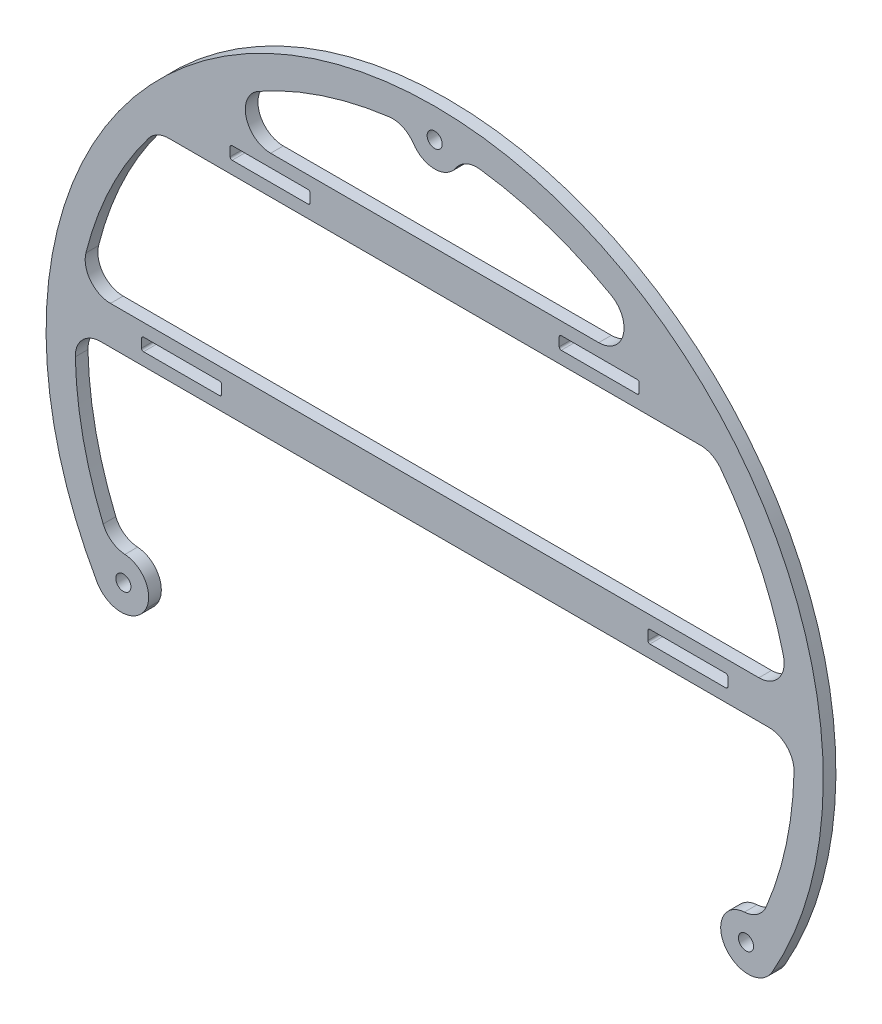
from build123d import *

# Parameters (mm, degrees)
SKETCH1_R           = 97.4725
SKETCH1_R_2         = 90.17
BOSS_EXTRUDE1_DEPTH = 3.175
BOSS_EXTRUDE2_START = -3.175
BOSS_EXTRUDE2_DEPTH = 3.175
CIRPATTERN2_COUNT   = 3
CUT_EXTRUDE1_DEPTH  = 138.883491171
BOSS_EXTRUDE5_START = -3.175
SKETCH13_W          = 20.066
SKETCH13_H          = 3.175
BOSS_EXTRUDE5_DEPTH = 3.175
BOSS_EXTRUDE6_START = -3.175
SKETCH17_W          = 20.066
SKETCH17_H          = 3.175
BOSS_EXTRUDE6_DEPTH = 3.175
FILLET1_R           = 6.35
FILLET2_R           = 0.508


with BuildPart() as part:
    # Sketch1 → Boss-Extrude1 (new body)
    with BuildSketch(Plane.XY):
        Circle(SKETCH1_R)
        Circle(SKETCH1_R_2, mode=Mode.SUBTRACT)
    extrude(amount=BOSS_EXTRUDE1_DEPTH)

    # Sketch2 → Boss-Extrude2 (add)
    with BuildSketch(Plane.XY.offset(3.175).offset(BOSS_EXTRUDE2_START)):
        with BuildLine():
            ThreePointArc((-5.291472464, 86.659612676), (0, 83.82), (5.291472464, 86.659612676))
            ThreePointArc((5.291472464, 86.659612676), (7.940261692, 88.923194985), (11.38468318, 89.448409091))
            ThreePointArc((11.38468318, 89.448409091), (0, 90.17), (-11.38468318, 89.448409091))
            ThreePointArc((-11.38468318, 89.448409091), (-7.940261692, 88.923194985), (-5.291472464, 86.659612676))
        make_face()
    boss_extrude2 = extrude(amount=BOSS_EXTRUDE2_DEPTH)

    # Sketch7 → #6 Clearance Hole2 (revolve, cut)
    with BuildSketch(Plane(origin=(0, 90.17, 0), x_dir=(0, 1, 0), z_dir=(1, 0, 0))):
        Polygon((0, 0), (0, 7.490824014), (1.89865, 6.35), (1.89865, 0), align=None)
    f_6_clearance_hole2 = revolve(axis=Axis((0, 90.17, -6.35), (0, 0, 1)), mode=Mode.SUBTRACT)

    # CirPattern2: Boss-Extrude2, #6 Clearance Hole2 ×3 about axis
    cirpattern2_axis = Axis((0, 0, 0), (0, 0, 1))
    add([boss_extrude2.rotate(cirpattern2_axis, i * 360 / CIRPATTERN2_COUNT) for i in range(1, CIRPATTERN2_COUNT)])
    add([f_6_clearance_hole2.rotate(cirpattern2_axis, i * 360 / CIRPATTERN2_COUNT) for i in range(1, CIRPATTERN2_COUNT)], mode=Mode.SUBTRACT)

    # Sketch14 → Cut-Extrude1 (cut, through all)
    with BuildSketch(Plane.XY.offset(3.175)):
        with BuildLine():
            ThreePointArc((-72.403689828, -47.912355915), (-78.441248685, -51.771990171), (-84.687137855, -48.259475113))
            ThreePointArc((-84.687137855, -48.259475113), (6.18e-07, -97.4725), (84.687138467, -48.25947404))
            ThreePointArc((84.687138467, -48.25947404), (78.441249322, -51.771989501), (72.403689828, -47.912355915))
            ThreePointArc((72.403689828, -47.912355915), (73.039614996, -51.33806583), (71.772253011, -54.583629393))
            ThreePointArc((71.772253011, -54.583629393), (0, -90.17), (-71.772253011, -54.583629393))
            ThreePointArc((-71.772253011, -54.583629393), (-73.039614996, -51.33806583), (-72.403689828, -47.912355915))
        make_face()
    extrude(amount=-CUT_EXTRUDE1_DEPTH, mode=Mode.SUBTRACT)

    # Sketch13 → Boss-Extrude5 (add)
    with BuildSketch(Plane.XY.offset(3.175).offset(BOSS_EXTRUDE5_START)):
        with BuildLine():
            Line((-90.0603735, 4.445), (90.0603735, 4.445))
            ThreePointArc((90.0603735, 4.445), (89.697330897, 9.220505951), (89.081243817, 13.97))
            Line((89.081243817, 13.97), (-89.081243817, 13.97))
            ThreePointArc((-89.081243817, 13.97), (-89.697330897, 9.220505951), (-90.0603735, 4.445))
        make_face()
        with Locations((-63.5, 9.2075)):
            Rectangle(SKETCH13_W, SKETCH13_H, mode=Mode.SUBTRACT)
        with Locations((63.5, 9.2075)):
            Rectangle(SKETCH13_W, SKETCH13_H, mode=Mode.SUBTRACT)
    extrude(amount=BOSS_EXTRUDE5_DEPTH)

    # Sketch17 → Boss-Extrude6 (add)
    with BuildSketch(Plane.XY.offset(3.175).offset(BOSS_EXTRUDE6_START)):
        with BuildLine():
            Line((-60.704804382, 66.675), (60.704804382, 66.675))
            ThreePointArc((60.704804382, 66.675), (65.399047227, 62.0773189), (69.746013506, 57.15))
            Line((69.746013506, 57.15), (-69.746013506, 57.15))
            ThreePointArc((-69.746013506, 57.15), (-65.399047227, 62.0773189), (-60.704804382, 66.675))
        make_face()
        with Locations((-41.275, 61.9125)):
            Rectangle(SKETCH17_W, SKETCH17_H, mode=Mode.SUBTRACT)
        with Locations((41.275, 61.9125)):
            Rectangle(SKETCH17_W, SKETCH17_H, mode=Mode.SUBTRACT)
    extrude(amount=BOSS_EXTRUDE6_DEPTH)

    # Fillet1
    fillet1_edges = [part.edges().sort_by_distance(p)[0] for p in [
        (69.746013506, 57.15, 1.5875),
        (60.704804382, 66.675, 1.5875),
        (-60.704804382, 66.675, 1.5875),
        (-69.746013506, 57.15, 1.5875),
        (90.0603735, 4.445, 1.5875),
        (89.081243817, 13.97, 1.5875),
        (-89.081243817, 13.97, 1.5875),
        (-90.0603735, 4.445, 1.5875),
    ]]
    fillet(fillet1_edges, radius=FILLET1_R)

    # Fillet2
    fillet2_edges = [part.edges().sort_by_distance(p)[0] for p in [
        (-51.308, 60.325, 1.5875),
        (-31.242, 60.325, 1.5875),
        (-31.242, 63.5, 1.5875),
        (-51.308, 63.5, 1.5875),
        (31.242, 60.325, 1.5875),
        (51.308, 60.325, 1.5875),
        (51.308, 63.5, 1.5875),
        (31.242, 63.5, 1.5875),
        (-73.533, 7.62, 1.5875),
        (-53.467, 7.62, 1.5875),
        (-53.467, 10.795, 1.5875),
        (-73.533, 10.795, 1.5875),
        (53.467, 7.62, 1.5875),
        (73.533, 7.62, 1.5875),
        (73.533, 10.795, 1.5875),
        (53.467, 10.795, 1.5875),
    ]]
    fillet(fillet2_edges, radius=FILLET2_R)


solid = part.part
